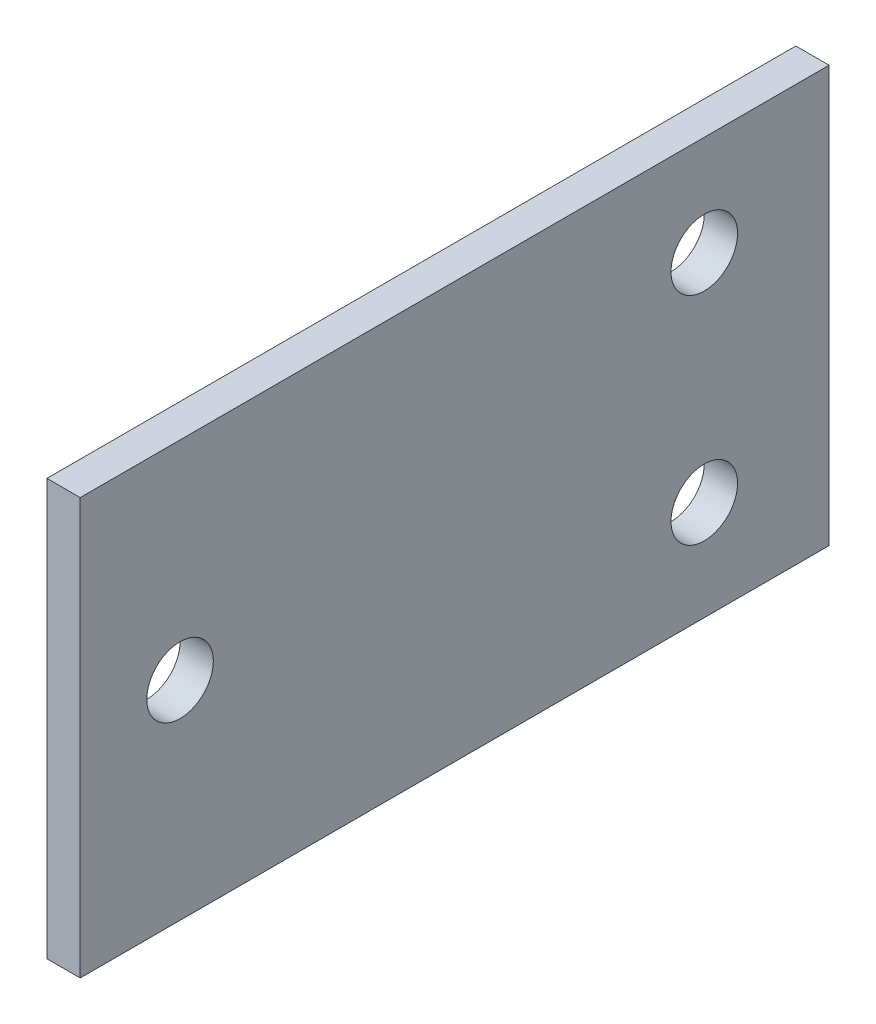
from build123d import *

# Parameters (mm, degrees)
SKETCH1_W           = 4
SKETCH1_H           = 90
BOSS_EXTRUDE1_DEPTH = 50
SKETCH2_R           = 4
CUT_EXTRUDE1_DEPTH  = 10


with BuildPart() as part:
    # Sketch1 → Boss-Extrude1 (new body)
    with BuildSketch(Plane(origin=(0, 0, 0), x_dir=(1, 0, 0), z_dir=(0, 1, 0))):
        Rectangle(SKETCH1_W, SKETCH1_H)
    extrude(amount=BOSS_EXTRUDE1_DEPTH)

    # Sketch2 → Cut-Extrude1 (cut)
    with BuildSketch(Plane(origin=(2, 0, 0), x_dir=(0, 0, -1), z_dir=(1, 0, 0))):
        with Locations((-33, 25)):
            Circle(SKETCH2_R)
        with Locations((30, 38)):
            Circle(SKETCH2_R)
        with Locations((30, 12)):
            Circle(SKETCH2_R)
    extrude(amount=-CUT_EXTRUDE1_DEPTH, mode=Mode.SUBTRACT)


solid = part.part
